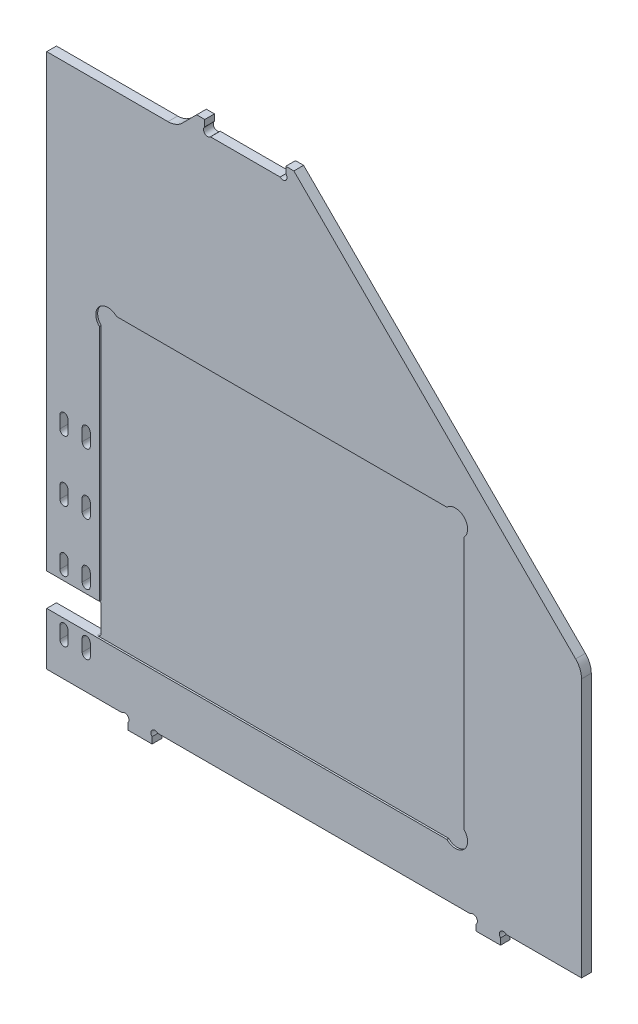
from build123d import *

# Parameters (mm, degrees)
BOSS_EXTRUDE1_DEPTH = 2.4
CUT_EXTRUDE1_REACH  = 98.968
CUT_EXTRUDE2_DEPTH  = 0.45
CUT_EXTRUDE3_REACH  = 98.958
FILLET1_R           = 5


with BuildPart() as part:
    # Sketch1 → Boss-Extrude1 (new body)
    with BuildSketch(Plane.XY):
        with BuildLine():
            Line((66, 0), (-5, 71))
            Line((-5, 71), (-7, 71))
            Line((-7, 71), (-7, 69.414213562))
            ThreePointArc((-7, 69.414213562), (-7, 68), (-8.414213562, 68))
            Line((-8.414213562, 68), (-25.585786438, 68))
            ThreePointArc((-25.585786438, 68), (-27, 68), (-27, 69.414213562))
            Line((-27, 69.414213562), (-27, 71))
            Line((-27, 71), (-29, 71))
            Line((-29, 71), (-34, 66))
            Line((-34, 66), (-66, 66))
            Line((-66, 66), (-66, -66))
            Line((-66, -66), (-47.414213562, -66))
            ThreePointArc((-47.414213562, -66), (-46, -66), (-46, -67.414213562))
            Line((-46, -67.414213562), (-46, -69))
            Line((-46, -69), (-40, -69))
            Line((-40, -69), (-40, -67.414213562))
            ThreePointArc((-40, -67.414213562), (-40, -66), (-38.585786438, -66))
            Line((-38.585786438, -66), (38.585786438, -66))
            ThreePointArc((38.585786438, -66), (40, -66), (40, -67.414213562))
            Line((40, -67.414213562), (40, -69))
            Line((40, -69), (46, -69))
            Line((46, -69), (46, -67.414213562))
            ThreePointArc((46, -67.414213562), (46, -66), (47.414213562, -66))
            Line((47.414213562, -66), (66, -66))
            Line((66, -66), (66, 0))
        make_face()
    extrude(amount=BOSS_EXTRUDE1_DEPTH)

    # Sketch3 → Cut-Extrude1 (cut, up to next)
    with BuildSketch(Plane.XY.offset(2.4), mode=Mode.PRIVATE) as cut_extrude1_sk1:
        with BuildLine():
            Line((-60.75, -13), (-60.75, -10))
            ThreePointArc((-60.75, -10), (-61.75, -9), (-62.75, -10))
            Line((-62.75, -10), (-62.75, -13))
            ThreePointArc((-62.75, -13), (-61.75, -14), (-60.75, -13))
        make_face()
    cut_extrude1_tool1 = extrude(cut_extrude1_sk1.sketch, amount=-CUT_EXTRUDE1_REACH, mode=Mode.PRIVATE) & part.part
    # Sketch3 → Cut-Extrude1 (cut, up to next)
    with BuildSketch(Plane.XY.offset(2.4), mode=Mode.PRIVATE) as cut_extrude1_sk2:
        with BuildLine():
            ThreePointArc((-55.25, -10), (-56.25, -9), (-57.25, -10))
            Line((-57.25, -10), (-57.25, -13))
            ThreePointArc((-57.25, -13), (-56.25, -14), (-55.25, -13))
            Line((-55.25, -13), (-55.25, -10))
        make_face()
    cut_extrude1_tool2 = extrude(cut_extrude1_sk2.sketch, amount=-CUT_EXTRUDE1_REACH, mode=Mode.PRIVATE) & part.part
    # Sketch3 → Cut-Extrude1 (cut, up to next)
    with BuildSketch(Plane.XY.offset(2.4), mode=Mode.PRIVATE) as cut_extrude1_sk3:
        with BuildLine():
            Line((-60.75, -28), (-60.75, -25))
            ThreePointArc((-60.75, -25), (-61.75, -24), (-62.75, -25))
            Line((-62.75, -25), (-62.75, -28))
            ThreePointArc((-62.75, -28), (-61.75, -29), (-60.75, -28))
        make_face()
    cut_extrude1_tool3 = extrude(cut_extrude1_sk3.sketch, amount=-CUT_EXTRUDE1_REACH, mode=Mode.PRIVATE) & part.part
    # Sketch3 → Cut-Extrude1 (cut, up to next)
    with BuildSketch(Plane.XY.offset(2.4), mode=Mode.PRIVATE) as cut_extrude1_sk4:
        with BuildLine():
            ThreePointArc((-55.25, -25), (-56.25, -24), (-57.25, -25))
            Line((-57.25, -25), (-57.25, -28))
            ThreePointArc((-57.25, -28), (-56.25, -29), (-55.25, -28))
            Line((-55.25, -28), (-55.25, -25))
        make_face()
    cut_extrude1_tool4 = extrude(cut_extrude1_sk4.sketch, amount=-CUT_EXTRUDE1_REACH, mode=Mode.PRIVATE) & part.part
    # Sketch3 → Cut-Extrude1 (cut, up to next)
    with BuildSketch(Plane.XY.offset(2.4), mode=Mode.PRIVATE) as cut_extrude1_sk5:
        with BuildLine():
            Line((-60.75, -43), (-60.75, -40))
            ThreePointArc((-60.75, -40), (-61.75, -39), (-62.75, -40))
            Line((-62.75, -40), (-62.75, -43))
            ThreePointArc((-62.75, -43), (-61.75, -44), (-60.75, -43))
        make_face()
    cut_extrude1_tool5 = extrude(cut_extrude1_sk5.sketch, amount=-CUT_EXTRUDE1_REACH, mode=Mode.PRIVATE) & part.part
    # Sketch3 → Cut-Extrude1 (cut, up to next)
    with BuildSketch(Plane.XY.offset(2.4), mode=Mode.PRIVATE) as cut_extrude1_sk6:
        with BuildLine():
            ThreePointArc((-55.25, -40), (-56.25, -39), (-57.25, -40))
            Line((-57.25, -40), (-57.25, -43))
            ThreePointArc((-57.25, -43), (-56.25, -44), (-55.25, -43))
            Line((-55.25, -43), (-55.25, -40))
        make_face()
    cut_extrude1_tool6 = extrude(cut_extrude1_sk6.sketch, amount=-CUT_EXTRUDE1_REACH, mode=Mode.PRIVATE) & part.part
    # Sketch3 → Cut-Extrude1 (cut, up to next)
    with BuildSketch(Plane.XY.offset(2.4), mode=Mode.PRIVATE) as cut_extrude1_sk7:
        with BuildLine():
            Line((-60.75, -58), (-60.75, -55))
            ThreePointArc((-60.75, -55), (-61.75, -54), (-62.75, -55))
            Line((-62.75, -55), (-62.75, -58))
            ThreePointArc((-62.75, -58), (-61.75, -59), (-60.75, -58))
        make_face()
    cut_extrude1_tool7 = extrude(cut_extrude1_sk7.sketch, amount=-CUT_EXTRUDE1_REACH, mode=Mode.PRIVATE) & part.part
    # Sketch3 → Cut-Extrude1 (cut, up to next)
    with BuildSketch(Plane.XY.offset(2.4), mode=Mode.PRIVATE) as cut_extrude1_sk8:
        with BuildLine():
            ThreePointArc((-55.25, -55), (-56.25, -54), (-57.25, -55))
            Line((-57.25, -55), (-57.25, -58))
            ThreePointArc((-57.25, -58), (-56.25, -59), (-55.25, -58))
            Line((-55.25, -58), (-55.25, -55))
        make_face()
    cut_extrude1_tool8 = extrude(cut_extrude1_sk8.sketch, amount=-CUT_EXTRUDE1_REACH, mode=Mode.PRIVATE) & part.part
    add(cut_extrude1_tool1.solids().sort_by_distance((-61.75, -11.5, 2.4))[0], mode=Mode.SUBTRACT)
    add(cut_extrude1_tool2.solids().sort_by_distance((-56.25, -11.5, 2.4))[0], mode=Mode.SUBTRACT)
    add(cut_extrude1_tool3.solids().sort_by_distance((-61.75, -26.5, 2.4))[0], mode=Mode.SUBTRACT)
    add(cut_extrude1_tool4.solids().sort_by_distance((-56.25, -26.5, 2.4))[0], mode=Mode.SUBTRACT)
    add(cut_extrude1_tool5.solids().sort_by_distance((-61.75, -41.5, 2.4))[0], mode=Mode.SUBTRACT)
    add(cut_extrude1_tool6.solids().sort_by_distance((-56.25, -41.5, 2.4))[0], mode=Mode.SUBTRACT)
    add(cut_extrude1_tool7.solids().sort_by_distance((-61.75, -56.5, 2.4))[0], mode=Mode.SUBTRACT)
    add(cut_extrude1_tool8.solids().sort_by_distance((-56.25, -56.5, 2.4))[0], mode=Mode.SUBTRACT)

    # Sketch4 → Cut-Extrude2 (cut)
    with BuildSketch(Plane.XY.offset(2.4)):
        with BuildLine():
            Line((-53, 13.757359313), (-53, -45))
            Line((-53, -45), (-66, -45))
            Line((-66, -45), (-66, -53))
            Line((-66, -53), (32.757359313, -53))
            ThreePointArc((32.757359313, -53), (37, -53), (37, -48.757359313))
            Line((37, -48.757359313), (37, 13.757359313))
            ThreePointArc((37, 13.757359313), (37, 18), (32.757359313, 18))
            Line((32.757359313, 18), (-48.757359313, 18))
            ThreePointArc((-48.757359313, 18), (-53, 18), (-53, 13.757359313))
        make_face()
    extrude(amount=-CUT_EXTRUDE2_DEPTH, mode=Mode.SUBTRACT)

    # Sketch5 → Cut-Extrude3 (cut, up to next)
    with BuildSketch(Plane.XY.offset(1.95), mode=Mode.PRIVATE) as cut_extrude3_sk1:
        with BuildLine():
            Line((-66, -45), (-54, -45))
            ThreePointArc((-54, -45), (-53.292893219, -45.292893219), (-53, -46))
            Line((-53, -46), (-53, -52))
            ThreePointArc((-53, -52), (-53.292893219, -52.707106781), (-54, -53))
            Line((-54, -53), (-66, -53))
            Line((-66, -53), (-66, -45))
        make_face()
    cut_extrude3_tool1 = extrude(cut_extrude3_sk1.sketch, amount=-CUT_EXTRUDE3_REACH, mode=Mode.PRIVATE) & part.part
    add(cut_extrude3_tool1.solids().sort_by_distance((-59.526011, -49, 1.95))[0], mode=Mode.SUBTRACT)

    # Fillet1
    fillet1_edges = [part.edges().sort_by_distance(p)[0] for p in [
        (66, 0, 1.2),
        (-34, 66, 1.2),
    ]]
    fillet(fillet1_edges, radius=FILLET1_R)


solid = part.part
